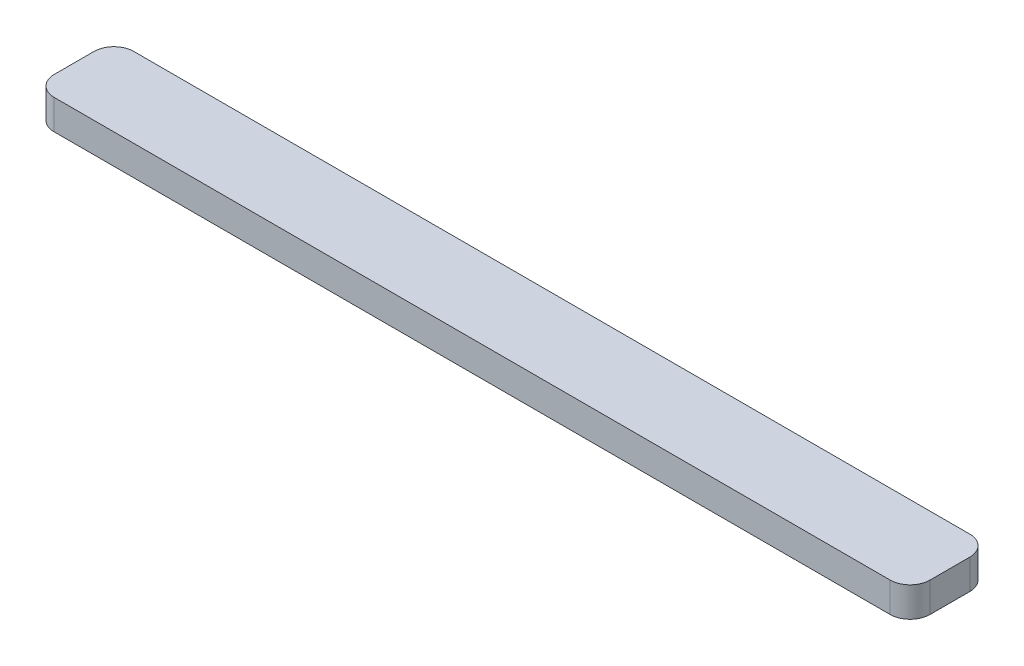
from build123d import *

# Parameters (mm, degrees)
EXTRUDE_1_DEPTH = 3


with BuildPart() as part:
    # 草图1 → 凸台-拉伸1 (new body)
    with BuildSketch(Plane(origin=(0, 0, 0), x_dir=(1, 0, 0), z_dir=(0, 1, 0))):
        with BuildLine():
            Line((42, -4), (-42, -4))
            ThreePointArc((-42, -4), (-43.414213562, -3.414213562), (-44, -2))
            Line((-44, -2), (-44, 2))
            ThreePointArc((-44, 2), (-43.414213562, 3.414213562), (-42, 4))
            Line((-42, 4), (42, 4))
            ThreePointArc((42, 4), (43.414213562, 3.414213562), (44, 2))
            Line((44, 2), (44, -2))
            ThreePointArc((44, -2), (43.414213562, -3.414213562), (42, -4))
        make_face()
    extrude(amount=EXTRUDE_1_DEPTH)


solid = part.part
